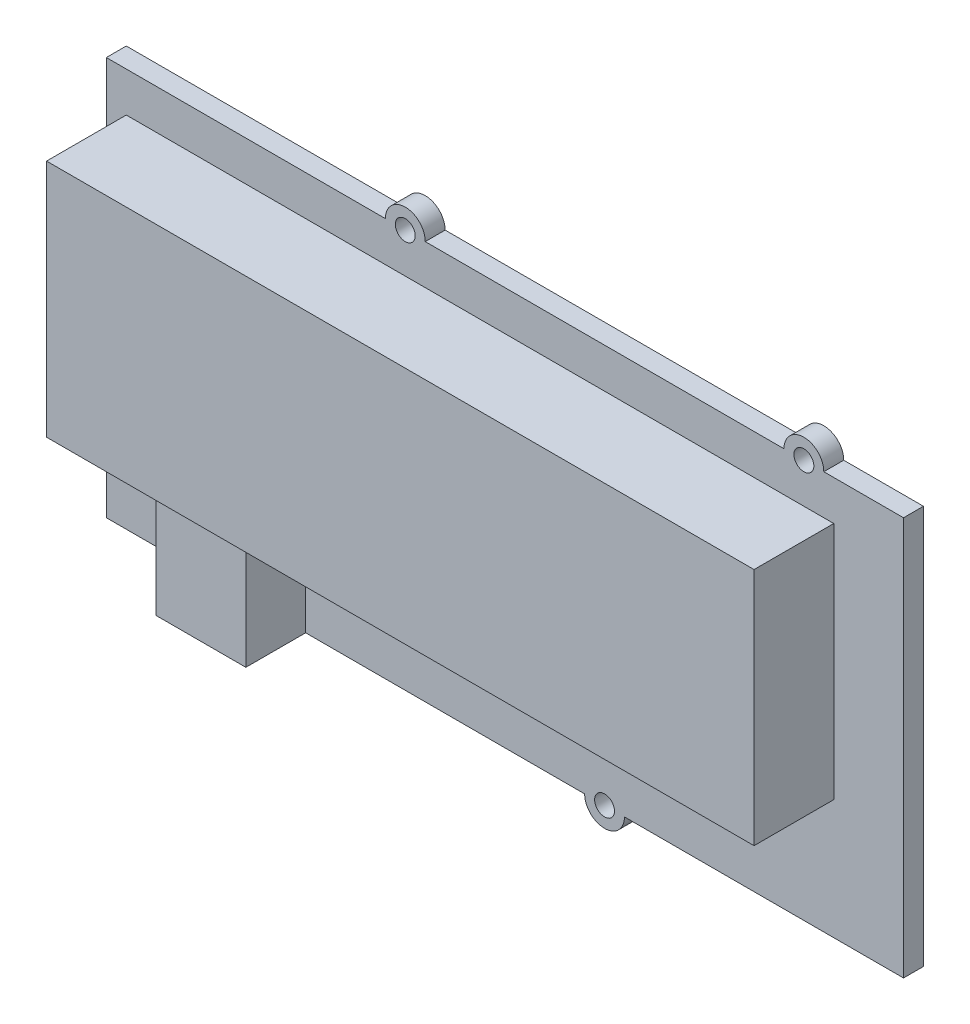
from build123d import *

# Parameters (mm, degrees)
ESQUISSE1_R        = 1
BOSS_EXTRU_1_DEPTH = 2
ESQUISSE2_W        = 71
ESQUISSE2_H        = 24
BOSS_EXTRU_3_DEPTH = 8
ESQUISSE4_W        = 9
ESQUISSE4_H        = 12
BOSS_EXTRU_4_DEPTH = 6


with BuildPart() as part:
    # Esquisse1 → Boss.-Extru.1 (new body)
    with BuildSketch(Plane.XY):
        with BuildLine():
            Line((-47.60021768, -30.24324737), (0.39978232, -30.24324737))
            ThreePointArc((0.39978232, -30.24324737), (2.39978232, -32.24324737), (4.39978232, -30.24324737))
            Line((4.39978232, -30.24324737), (32.39978232, -30.24324737))
            Line((32.39978232, -30.24324737), (32.39978232, 9.75675263))
            Line((32.39978232, 9.75675263), (24.39978232, 9.75675263))
            ThreePointArc((24.39978232, 9.75675263), (22.39978232, 11.75675263), (20.39978232, 9.75675263))
            Line((20.39978232, 9.75675263), (-15.60021768, 9.75675263))
            ThreePointArc((-15.60021768, 9.75675263), (-17.60021768, 11.75675263), (-19.60021768, 9.75675263))
            Line((-19.60021768, 9.75675263), (-47.60021768, 9.75675263))
            Line((-47.60021768, 9.75675263), (-47.60021768, -30.24324737))
        make_face()
        with Locations((22.39978232, 9.75675263)):
            Circle(ESQUISSE1_R, mode=Mode.SUBTRACT)
        with Locations((-17.60021768, 9.75675263)):
            Circle(ESQUISSE1_R, mode=Mode.SUBTRACT)
        with Locations((2.39978232, -30.24324737)):
            Circle(ESQUISSE1_R, mode=Mode.SUBTRACT)
    extrude(amount=BOSS_EXTRU_1_DEPTH)

    # Esquisse2 → Boss.-Extru.3 (add)
    with BuildSketch(Plane.XY.offset(2)):
        with Locations((-10.10021768, -6.24324737)):
            Rectangle(ESQUISSE2_W, ESQUISSE2_H)
    extrude(amount=BOSS_EXTRU_3_DEPTH)

    # Esquisse4 → Boss.-Extru.4 (add)
    with BuildSketch(Plane.XY.offset(2)):
        with Locations((-32.10021768, -24.24324737)):
            Rectangle(ESQUISSE4_W, ESQUISSE4_H)
    extrude(amount=BOSS_EXTRU_4_DEPTH)


solid = part.part
